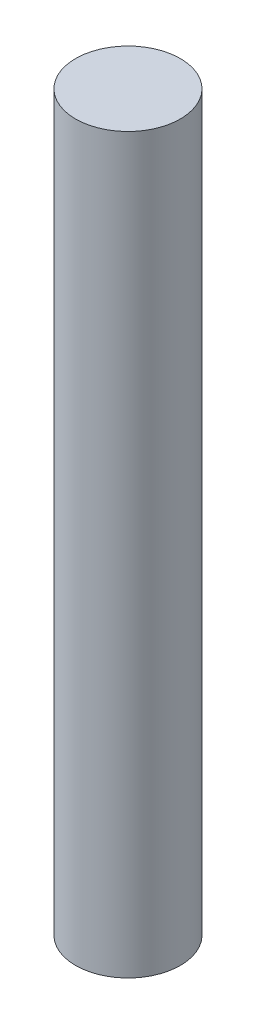
from build123d import *

# Parameters (mm, degrees)
SKETCH_1_R      = 2.5
EXTRUDE_1_DEPTH = 35


with BuildPart() as part:
    # 草图1 → 凸台-拉伸1 (new body)
    with BuildSketch(Plane(origin=(0, 0, 0), x_dir=(1, 0, 0), z_dir=(0, 1, 0))):
        with Locations(Location((0, 0, 0), (0, 0, 270))):
            Circle(SKETCH_1_R)
    extrude(amount=EXTRUDE_1_DEPTH)


solid = part.part
